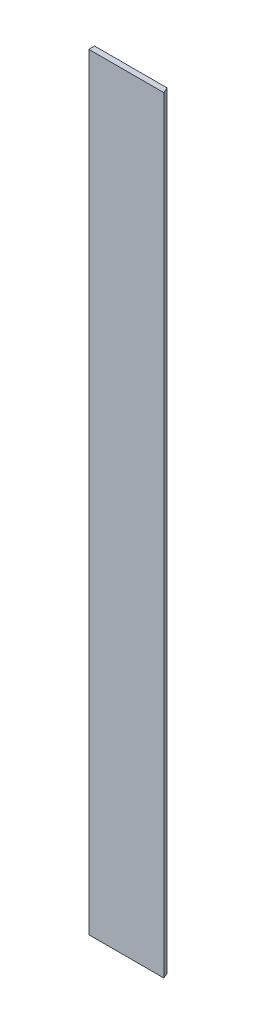
from build123d import *

# Parameters (mm, degrees)
EXTRUDE_1_DEPTH = 533.213673317


with BuildPart() as part:
    # Эскиз1 → Вытянуть1 (new body)
    with BuildSketch(Plane(origin=(0, 0, 0), x_dir=(1, 0, 0), z_dir=(0, 1, 0))):
        Polygon((0, -1), (50.485205308, -1), (52.102895451, -5), (0, -5), align=None)
    extrude(amount=EXTRUDE_1_DEPTH)


solid = part.part
